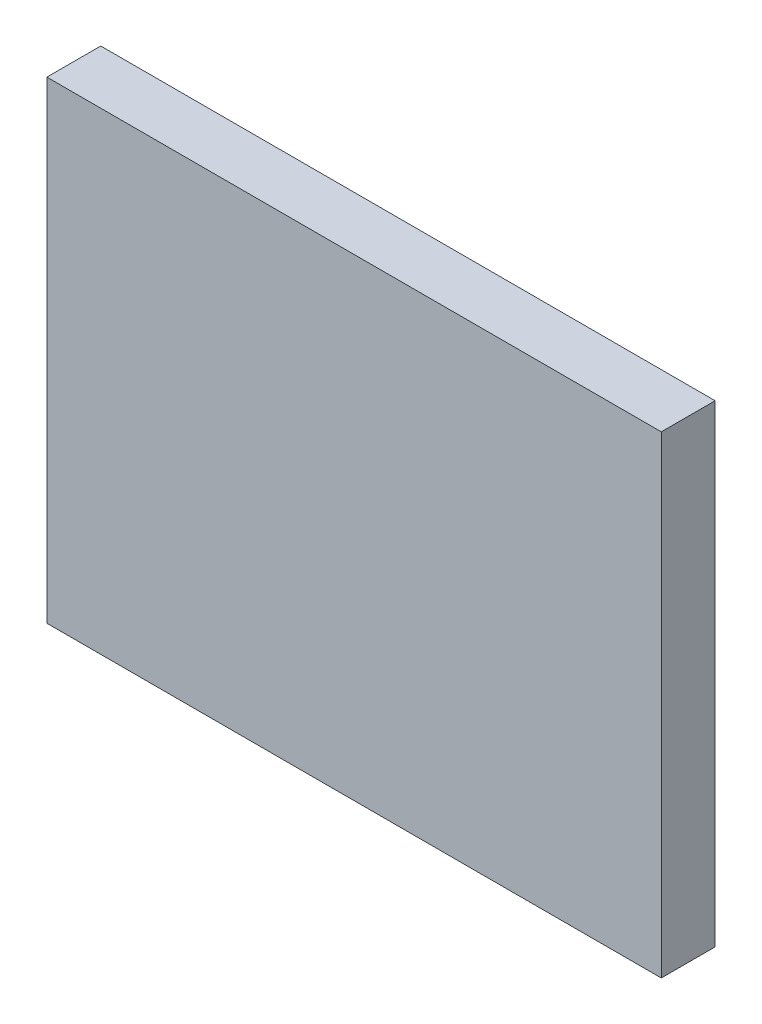
from build123d import *

# Parameters (mm, degrees)
IZIM1_W                     = 114.06546689
IZIM1_H                     = 87.815505618
Y_KSEKLIK_EKSTR_ZYON1_DEPTH = 10


with BuildPart() as part:
    # Çizim1 → Yükseklik-Ekstrüzyon1 (new body)
    with BuildSketch(Plane.XY):
        Rectangle(IZIM1_W, IZIM1_H)
    extrude(amount=Y_KSEKLIK_EKSTR_ZYON1_DEPTH)


solid = part.part
